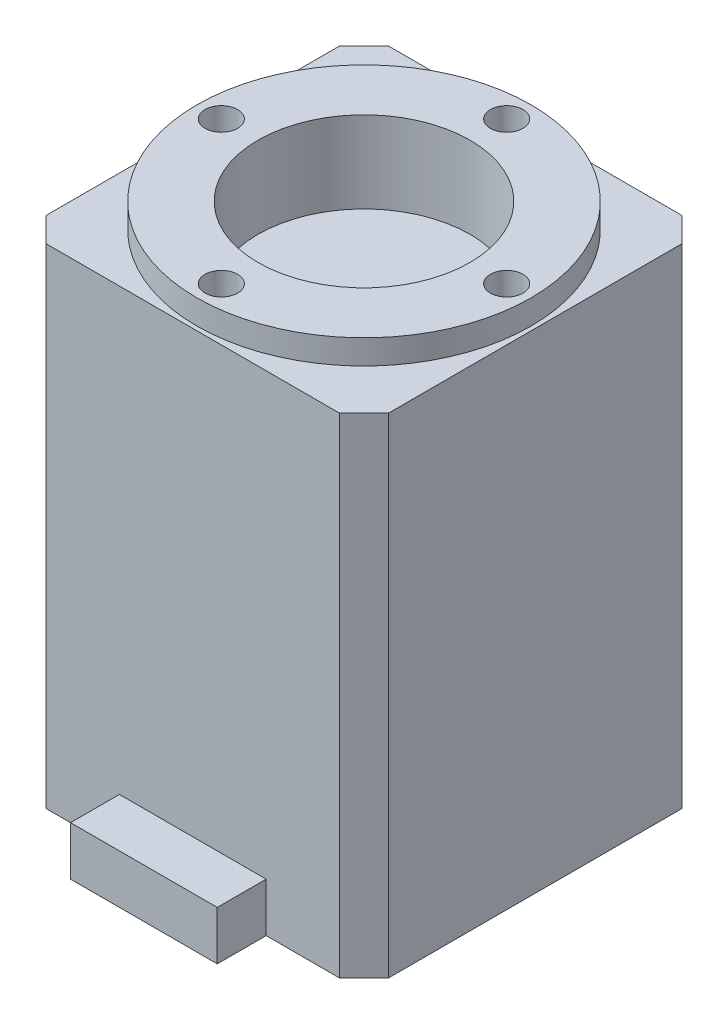
from build123d import *

# Parameters (mm, degrees)
ESQUISSE1_W             = 42
ESQUISSE1_H             = 42
BOSS_EXTRU_1_DEPTH      = 60
ESQUISSE2_R             = 20.5
BOSS_EXTRU_2_DEPTH      = 3
ESQUISSE3_R             = 13
ENL_V_MAT_EXTRU_1_DEPTH = 10
ESQUISSE4_R             = 2
ENL_V_MAT_EXTRU_2_DEPTH = 3.5
CHANFREIN1_SIZE         = 3
ESQUISSE5_W             = 18
ESQUISSE5_H             = 6
BOSS_EXTRU_3_DEPTH      = 6


with BuildPart() as part:
    # Esquisse1 → Boss.-Extru.1 (new body)
    with BuildSketch(Plane(origin=(0, 0, 0), x_dir=(1, 0, 0), z_dir=(0, 1, 0))):
        with Locations((21, 21)):
            Rectangle(ESQUISSE1_W, ESQUISSE1_H)
    extrude(amount=BOSS_EXTRU_1_DEPTH)

    # Esquisse2 → Boss.-Extru.2 (add)
    with BuildSketch(Plane(origin=(0, 60, 0), x_dir=(1, 0, 0), z_dir=(0, 1, 0))):
        with Locations(Location((21, 21, 0), (0, 0, 270))):
            Circle(ESQUISSE2_R)
    extrude(amount=BOSS_EXTRU_2_DEPTH)

    # Esquisse3 → Enlèv. mat.-Extru.1 (cut)
    with BuildSketch(Plane(origin=(0, 63, 0), x_dir=(1, 0, 0), z_dir=(0, 1, 0))):
        with Locations(Location((21, 21, 0), (0, 0, 270))):
            Circle(ESQUISSE3_R)
    extrude(amount=-ENL_V_MAT_EXTRU_1_DEPTH, mode=Mode.SUBTRACT)

    # Esquisse4 → Enlèv. mat.-Extru.2 (cut)
    with BuildSketch(Plane(origin=(0, 63, 0), x_dir=(1, 0, 0), z_dir=(0, 1, 0))):
        with Locations(Location((3.5, 21, 0), (0, 0, 270))):
            Circle(ESQUISSE4_R)
        with Locations(Location((21, 38.5, 0), (0, 0, 270))):
            Circle(ESQUISSE4_R)
        with Locations(Location((38.5, 21, 0), (0, 0, 270))):
            Circle(ESQUISSE4_R)
        with Locations(Location((21, 3.5, 0), (0, 0, 270))):
            Circle(ESQUISSE4_R)
    extrude(amount=-ENL_V_MAT_EXTRU_2_DEPTH, mode=Mode.SUBTRACT)

    # Chanfrein1
    chanfrein1_edges = [part.edges().sort_by_distance(p)[0] for p in [
        (0, 30, -42),
        (42, 30, -42),
        (42, 30, 0),
        (0, 30, 0),
    ]]
    chamfer(chanfrein1_edges, length=CHANFREIN1_SIZE)

    # Esquisse5 → Boss.-Extru.3 (add)
    with BuildSketch(Plane.XY):
        with Locations((21, 3)):
            Rectangle(ESQUISSE5_W, ESQUISSE5_H)
    extrude(amount=BOSS_EXTRU_3_DEPTH)


solid = part.part
